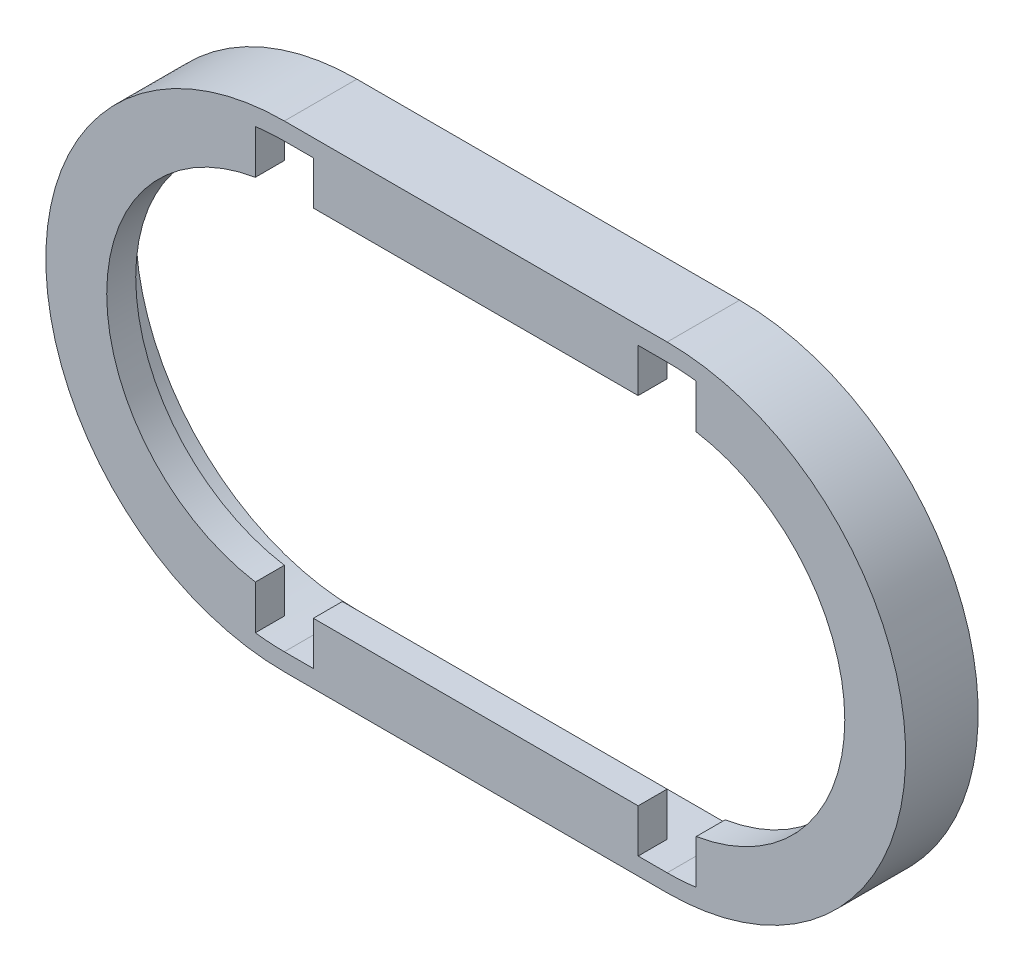
from build123d import *

# Parameters (mm, degrees)
BOSS_EXTRUDE1_DEPTH      = 2
BOSS_EXTRUDE1_DEPTH_BACK = 3
BOSS_EXTRUDE2_START      = -2
SKETCH2_W                = 22.4
SKETCH2_H                = 3
BOSS_EXTRUDE2_DEPTH      = 2


with BuildPart() as part:
    # Sketch1 → Boss-Extrude1 (new, two sides: drawn at the far end of the back side and taken through both)
    with BuildSketch(Plane.XY.offset(-BOSS_EXTRUDE1_DEPTH_BACK)):
        with BuildLine():
            Line((-34.384444189, 19.919216619), (-7.984444189, 19.919216619))
            ThreePointArc((-7.984444189, 19.919216619), (8.465555811, 3.469216619), (-7.984444189, -12.980783381))
            Line((-7.984444189, -12.980783381), (-34.384444189, -12.980783381))
            ThreePointArc((-34.384444189, -12.980783381), (-50.834444189, 3.469216619), (-34.384444189, 19.919216619))
        make_face()
        with BuildLine():
            Line((-34.384444189, 18.719216619), (-7.984444189, 18.719216619))
            ThreePointArc((-7.984444189, 18.719216619), (7.265555811, 3.469216619), (-7.984444189, -11.780783381))
            Line((-7.984444189, -11.780783381), (-34.384444189, -11.780783381))
            ThreePointArc((-34.384444189, -11.780783381), (-49.634444189, 3.469216619), (-34.384444189, 18.719216619))
        make_face(mode=Mode.SUBTRACT)
    extrude(amount=BOSS_EXTRUDE1_DEPTH + BOSS_EXTRUDE1_DEPTH_BACK)

    # Sketch2 → Boss-Extrude2 (add)
    with BuildSketch(Plane.XY.offset(2).offset(BOSS_EXTRUDE2_START)):
        with BuildLine():
            ThreePointArc((-5.984444189, -11.649067014), (7.265555811, 3.469216619), (-5.984444189, 18.587500252))
            Line((-5.984444189, 18.587500252), (-5.984444189, 15.554848584))
            ThreePointArc((-5.984444189, 15.554848584), (4.265555811, 3.469216619), (-5.984444189, -8.616415346))
            Line((-5.984444189, -8.616415346), (-5.984444189, -11.649067014))
        make_face()
        with Locations((-21.184444189, 17.219216619)):
            Rectangle(SKETCH2_W, SKETCH2_H)
        with Locations((-21.184444189, -10.280783381)):
            Rectangle(SKETCH2_W, SKETCH2_H)
        with BuildLine():
            ThreePointArc((-36.384444189, -8.616415346), (-46.634444189, 3.469216619), (-36.384444189, 15.554848584))
            Line((-36.384444189, 15.554848584), (-36.384444189, 18.587500252))
            ThreePointArc((-36.384444189, 18.587500252), (-49.634444189, 3.469216619), (-36.384444189, -11.649067014))
            Line((-36.384444189, -11.649067014), (-36.384444189, -8.616415346))
        make_face()
    extrude(amount=BOSS_EXTRUDE2_DEPTH)


solid = part.part
